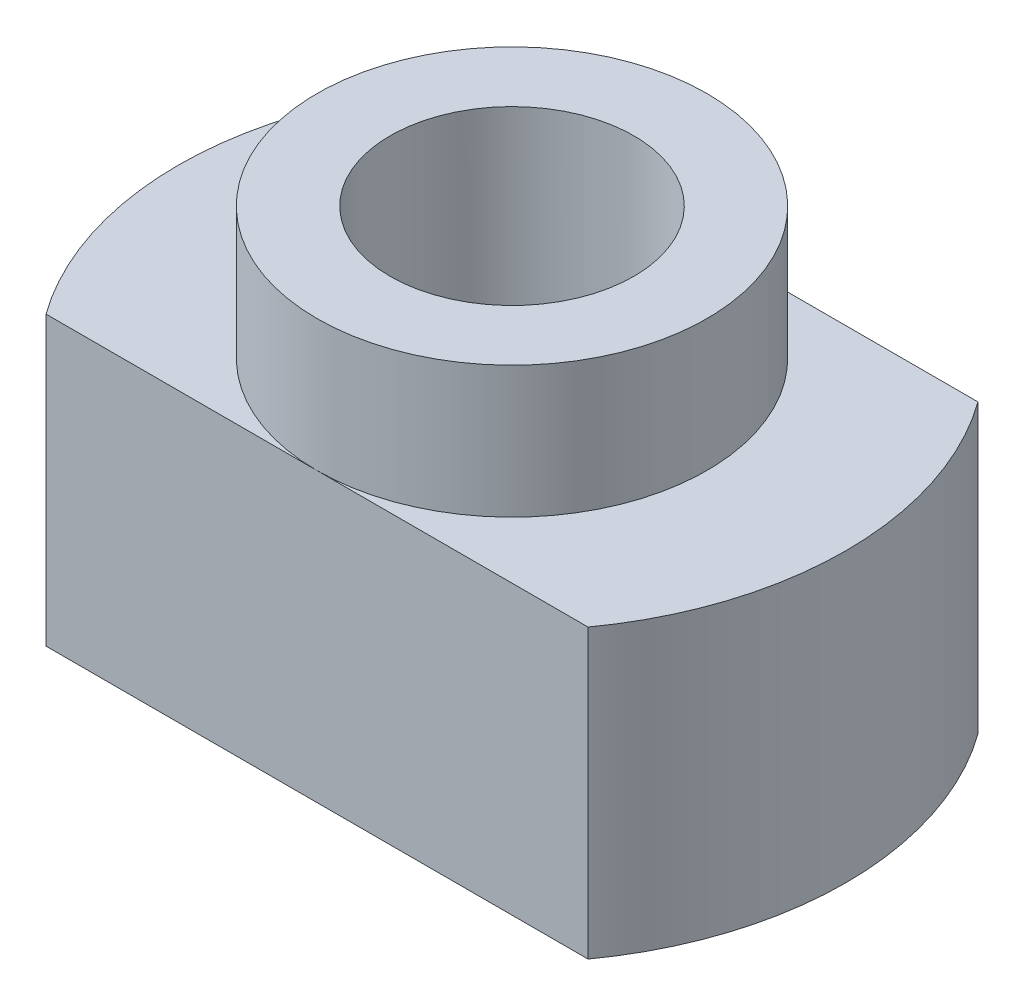
from build123d import *

# Parameters (mm, degrees)
SKETCH_6_W             = 19.342786847
SKETCH_6_H             = 6.481709878
CUT_EXTRUDE_2_DEPTH    = 12.342618745
HOLE_WIZARD_M6_1_D     = 5
HOLE_WIZARD_M6_1_DEPTH = 28
HOLE_WIZARD_M6_1_TIP   = 1.502151548


with BuildPart() as part:
    # 草图4 → 旋转2 (revolve)
    with BuildSketch(Plane.XY, mode=Mode.PRIVATE) as revolve_2_sk:
        Polygon((0, 0), (0, 8.6), (4, 8.6), (4, 5.9), (6.85, 5.9), (6.85, 0), align=None)
    revolve(revolve_2_sk.sketch.rotate(Axis((0, 0, 0), (0, 1, 0)), 90), axis=Axis((0, 0, 0), (0, 1, 0)))

    # 草图6 → 切除-拉伸2 (cut, through all)
    with BuildSketch(Plane(origin=(0, 5.9, 0), x_dir=(1, 0, 0), z_dir=(0, 1, 0))):
        with Locations((-1.599688833, 7.240854939)):
            Rectangle(SKETCH_6_W, SKETCH_6_H)
        with Locations((-1.599688833, -7.240854939)):
            Rectangle(SKETCH_6_W, SKETCH_6_H)
    extrude(amount=-CUT_EXTRUDE_2_DEPTH, mode=Mode.SUBTRACT)

    # M6 螺纹孔1
    with Locations(Plane.ZX.offset(8.6)):
        with Locations((0, 0)):
            Hole(HOLE_WIZARD_M6_1_D / 2, depth=HOLE_WIZARD_M6_1_DEPTH)
            with Locations((0, 0, -(HOLE_WIZARD_M6_1_DEPTH + HOLE_WIZARD_M6_1_TIP / 2))):  # 118° drill point
                Cone(0, HOLE_WIZARD_M6_1_D / 2, HOLE_WIZARD_M6_1_TIP, mode=Mode.SUBTRACT)


solid = part.part
